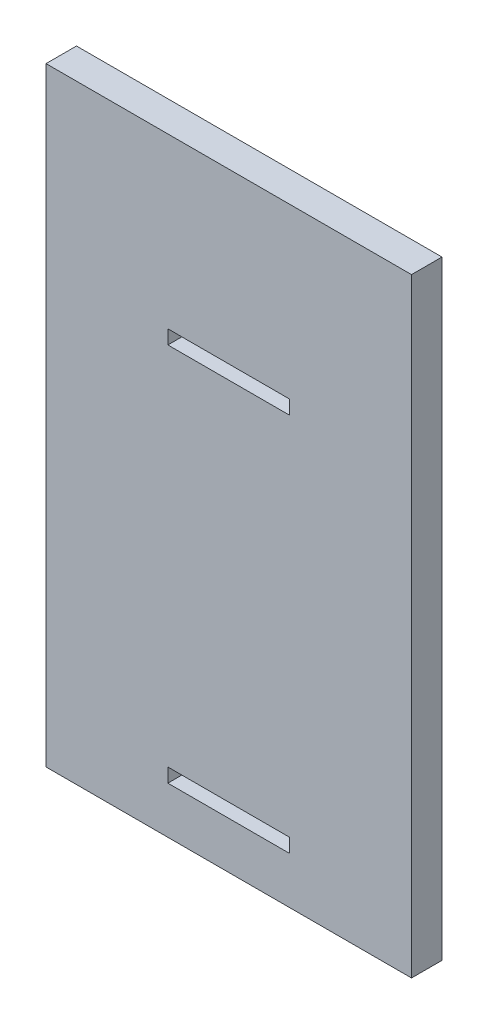
from build123d import *

# Parameters (mm, degrees)
FRAME_OUTLINE_W     = 3
FRAME_OUTLINE_H     = 5
FRAME_OUTLINE_W_2   = 1
FRAME_OUTLINE_H_2   = 0.115
BOSS_EXTRUDE1_DEPTH = 0.125


with BuildPart() as part:
    # frame_outline → Boss-Extrude1 (new, symmetric)
    with BuildSketch(Plane.XY):
        with Locations((1.5, 2.5)):
            Rectangle(FRAME_OUTLINE_W, FRAME_OUTLINE_H)
        with Locations((1.5, 3.5575)):
            Rectangle(FRAME_OUTLINE_W_2, FRAME_OUTLINE_H_2, mode=Mode.SUBTRACT)
        with Locations((1.5, 0.4425)):
            Rectangle(FRAME_OUTLINE_W_2, FRAME_OUTLINE_H_2, mode=Mode.SUBTRACT)
    extrude(amount=BOSS_EXTRUDE1_DEPTH, both=True)


solid = part.part
